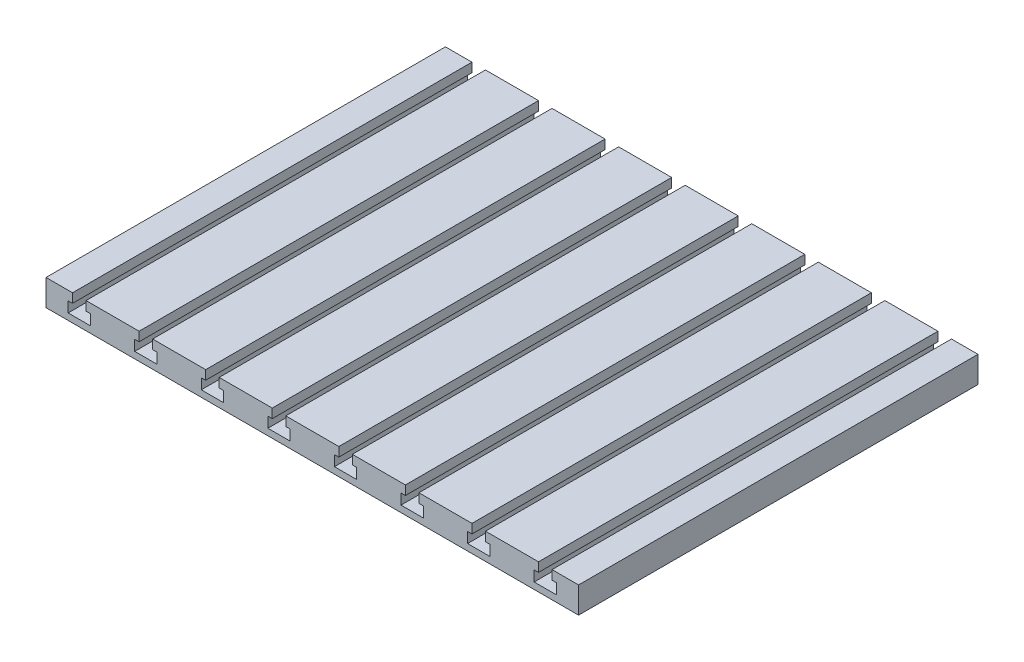
from build123d import *

# Parameters (mm, degrees)
BOSS_EXTRUDE1_DEPTH = 304.8


with BuildPart() as part:
    # Sketch1 → Boss-Extrude1 (new body)
    with BuildSketch(Plane.XY):
        Polygon((30.5562, 12.9794), (33.8963, 12.9794), (33.8963, 4.9784), (16.9037, 4.9784), (16.9037, 12.9794), (20.2438, 12.9794), (20.2438, 19.9898), (0, 19.9898), (0, 0), (406.4, 0), (406.4, 19.9898), (386.1562, 19.9898), (386.1562, 12.9794), (389.4963, 12.9794), (389.4963, 4.9784), (372.5037, 4.9784), (372.5037, 12.9794), (375.8438, 12.9794), (375.8438, 19.9898), (335.3562, 19.9898), (335.3562, 12.9794), (338.6963, 12.9794), (338.6963, 4.9784), (321.7037, 4.9784), (321.7037, 12.9794), (325.0438, 12.9794), (325.0438, 19.9898), (284.5562, 19.9898), (284.5562, 12.9794), (287.8963, 12.9794), (287.8963, 4.9784), (270.9037, 4.9784), (270.9037, 12.9794), (274.2438, 12.9794), (274.2438, 19.9898), (233.7562, 19.9898), (233.7562, 12.9794), (237.0963, 12.9794), (237.0963, 4.9784), (220.1037, 4.9784), (220.1037, 12.9794), (223.4438, 12.9794), (223.4438, 19.9898), (182.9562, 19.9898), (182.9562, 12.9794), (186.2963, 12.9794), (186.2963, 4.9784), (169.3037, 4.9784), (169.3037, 12.9794), (172.6438, 12.9794), (172.6438, 19.9898), (132.1562, 19.9898), (132.1562, 12.9794), (135.4963, 12.9794), (135.4963, 4.9784), (118.5037, 4.9784), (118.5037, 12.9794), (121.8438, 12.9794), (121.8438, 19.9898), (81.3562, 19.9898), (81.3562, 12.9794), (84.6963, 12.9794), (84.6963, 4.9784), (67.7037, 4.9784), (67.7037, 12.9794), (71.0438, 12.9794), (71.0438, 19.9898), (30.5562, 19.9898), align=None)
    extrude(amount=BOSS_EXTRUDE1_DEPTH)


solid = part.part
